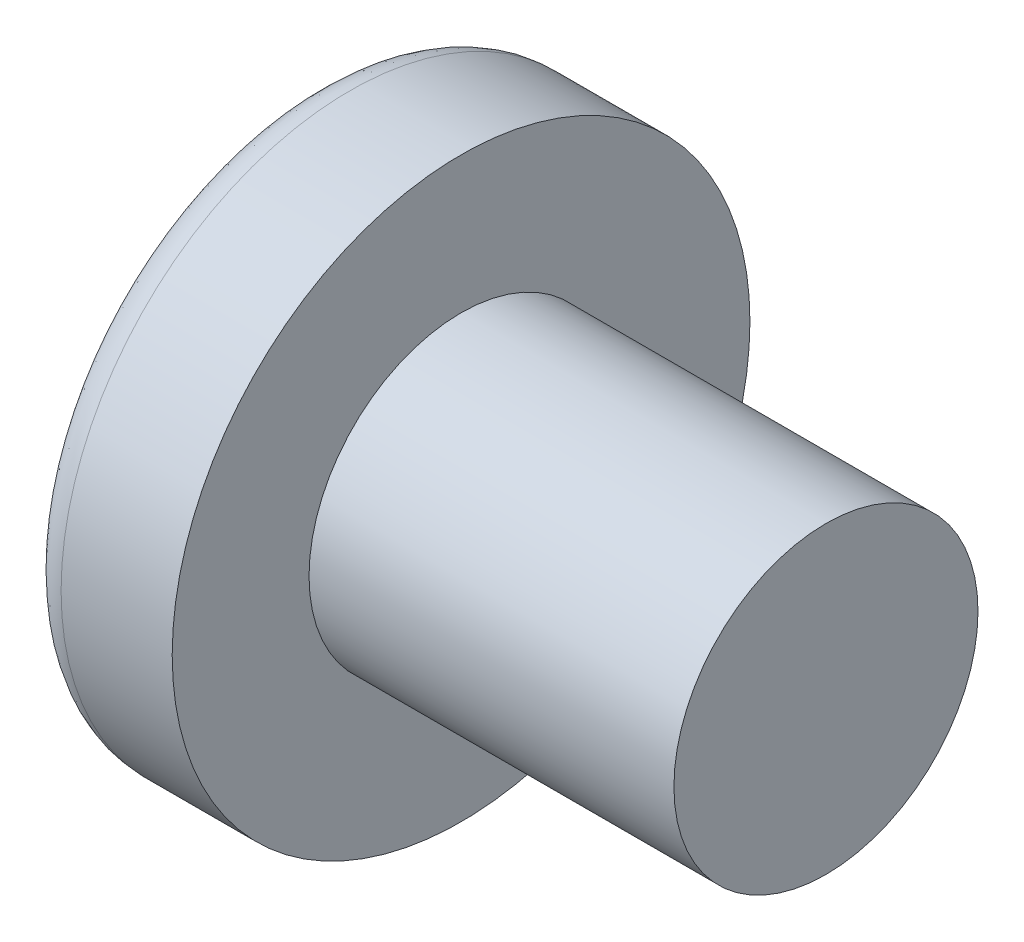
from build123d import *

# Parameters (mm, degrees)
CIRPATTERN1_COUNT = 2
CIRPATTERN1_ANGLE = 90


with BuildPart() as part:
    # BodySke → Base-Revolve (revolve)
    with BuildSketch(Plane.XY, mode=Mode.PRIVATE) as base_revolve_sk:
        with BuildLine():
            Line((3.7, 2.5), (3.7, 4.75))
            Line((3.7, 4.75), (1.873214546, 4.75))
            ThreePointArc((1.873214546, 4.75), (1.592049018, 4.680043343), (1.376448158, 4.486486486))
            ThreePointArc((1.376448158, 4.486486486), (0.351849415, 2.346442548), (0, 0))
            Line((0, 0), (9.7, 0))
            Line((9.7, 0), (9.7, 2.5))
            Line((9.7, 2.5), (3.7, 2.5))
        make_face()
    revolve(base_revolve_sk.sketch.rotate(Axis((-25.4, 0, 0), (1, 0, 0)), 90), axis=Axis((-25.4, 0, 0), (1, 0, 0)))

    # Sketch3 → Cut-Loft1 section 0
    with BuildSketch(Plane(origin=(0, 0, 0), x_dir=(0, 0, -1), z_dir=(1, 0, 0))):
        with BuildLine():
            Line((0.5, -2.45), (-0.5, -2.45))
            Line((-0.5, -2.45), (-0.5, 2.45))
            Line((-0.5, 2.45), (0.5, 2.45))
            Line((0.5, 2.45), (0.5, -2.45))
        make_face()
    # Sketch4 → Cut-Loft1 section 1
    with BuildSketch(Plane(origin=(2.95, 0, 0), x_dir=(0, 0, -1), z_dir=(1, 0, 0))):
        with BuildLine():
            Line((0.25, -0.25), (-0.25, -0.25))
            Line((-0.25, -0.25), (-0.25, 0.25))
            Line((-0.25, 0.25), (0.25, 0.25))
            Line((0.25, 0.25), (0.25, -0.25))
        make_face()
    cut_loft1 = loft(mode=Mode.SUBTRACT)

    # CirPattern1: Cut-Loft1 ×2 about axis
    cirpattern1_axis = Axis((0, 0, 0), (1, 0, 0))
    for i in range(1, CIRPATTERN1_COUNT):
        add(cut_loft1.rotate(cirpattern1_axis, i * CIRPATTERN1_ANGLE / (CIRPATTERN1_COUNT - 1)), mode=Mode.SUBTRACT)


solid = part.part
